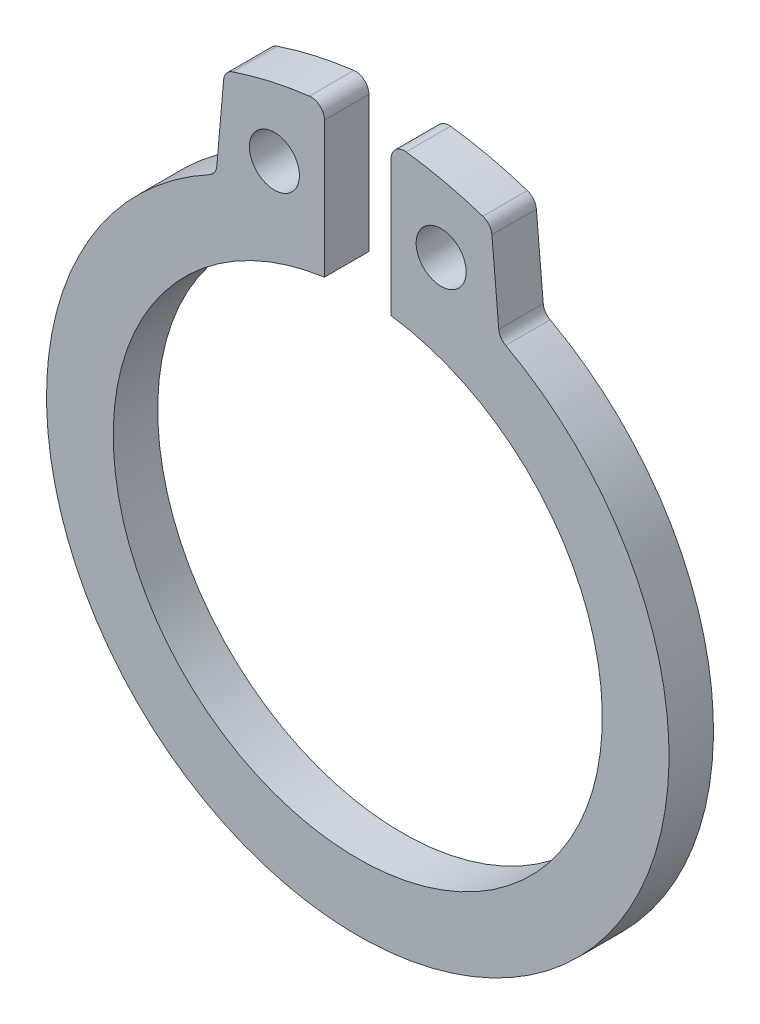
from build123d import *

# Parameters (mm, degrees)
SKETCH_1_R      = 0.5625
EXTRUDE_1_DEPTH = 1
FILLET_1_R      = 0.3
FILLET_2_R      = 0.3


with BuildPart() as part:
    # 草图1 → 凸台-拉伸1 (new body)
    with BuildSketch(Plane.XY):
        with BuildLine():
            Line((-0.75, 8.843253078), (-0.75, 5.448623679))
            ThreePointArc((-0.75, 5.448623679), (0, -5.5), (0.75, 5.448623679))
            Line((0.75, 5.448623679), (0.75, 8.843253078))
            ThreePointArc((0.75, 8.843253078), (1.890982428, 8.671205825), (3, 8.352581936))
            Line((3, 8.352581936), (3.185419652, 6.233225621))
            ThreePointArc((3.185419652, 6.233225621), (0, -7), (-3.185419652, 6.233225621))
            Line((-3.185419652, 6.233225621), (-3, 8.352581936))
            ThreePointArc((-3, 8.352581936), (-1.890982428, 8.671205825), (-0.75, 8.843253078))
        make_face()
        with Locations((-1.875, 7.145938379)):
            Circle(SKETCH_1_R, mode=Mode.SUBTRACT)
        with Locations(Location((1.875, 7.145938379, 0), (0, 0, 180))):
            Circle(SKETCH_1_R, mode=Mode.SUBTRACT)
    extrude(amount=EXTRUDE_1_DEPTH)

    # 圆角1
    fillet_1_edges = [part.edges().sort_by_distance(p)[0] for p in [
        (3, 8.352581936, 0.5),
        (-3, 8.352581936, 0.5),
    ]]
    fillet(fillet_1_edges, radius=FILLET_1_R)

    # 圆角2
    fillet_2_edges = [part.edges().sort_by_distance(p)[0] for p in [
        (3.185419652, 6.233225621, 0.5),
        (-3.185419652, 6.233225621, 0.5),
        (-0.75, 8.843253078, 0.5),
        (0.75, 8.843253078, 0.5),
    ]]
    fillet(fillet_2_edges, radius=FILLET_2_R)


solid = part.part
